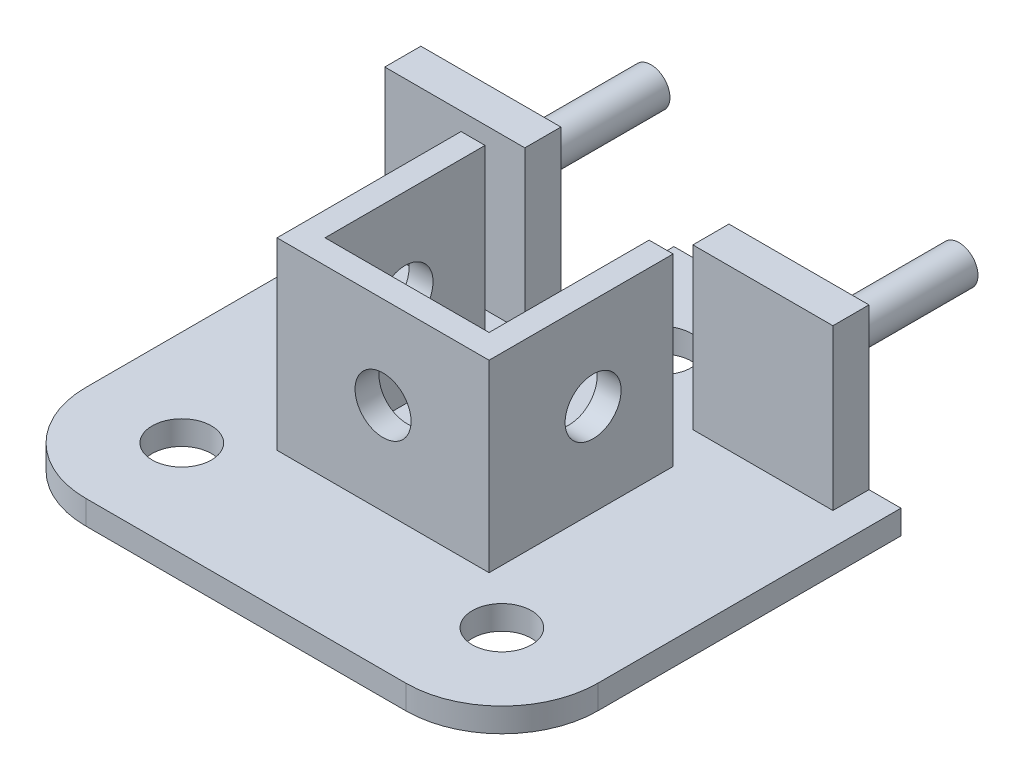
from build123d import *

# Parameters (mm, degrees)
SKETCH1_R           = 3.7
BOSS_EXTRUDE1_DEPTH = 3
SKETCH2_W           = 17.5
SKETCH2_H           = 4.507827608
BOSS_EXTRUDE2_DEPTH = 20
SKETCH3_R           = 2.375
BOSS_EXTRUDE3_DEPTH = 20
CUT_EXTRUDE1_REACH  = 71.092
SKETCH6_W           = 3
SKETCH6_H           = 20
BOSS_EXTRUDE4_DEPTH = 23
CUT_EXTRUDE2_REACH  = 79.931
SKETCH7_R           = 3.5
CUT_EXTRUDE3_REACH  = 68.934
SKETCH8_R           = 3.5


with BuildPart() as part:
    # Sketch1 → Boss-Extrude1 (new body)
    with BuildSketch(Plane(origin=(0, 0, 0), x_dir=(1, 0, 0), z_dir=(0, 1, 0))):
        with BuildLine():
            Line((-32, 0), (-32, 40))
            ThreePointArc((-32, 40), (-28.485281374, 48.485281374), (-20, 52))
            Line((-20, 52), (20, 52))
            ThreePointArc((20, 52), (28.485281374, 48.485281374), (32, 40))
            Line((32, 40), (32, 0))
            ThreePointArc((32, 0), (28.485281374, -8.485281374), (20, -12))
            Line((20, -12), (-20, -12))
            ThreePointArc((-20, -12), (-28.485281374, -8.485281374), (-32, 0))
        make_face()
        with Locations(Location((20, 0, 0), (0, 0, 270))):
            Circle(SKETCH1_R, mode=Mode.SUBTRACT)
        with Locations(Location((-20, 0, 0), (0, 0, 270))):
            Circle(SKETCH1_R, mode=Mode.SUBTRACT)
        with Locations(Location((0, 40, 0), (0, 0, 270))):
            Circle(SKETCH1_R, mode=Mode.SUBTRACT)
    extrude(amount=BOSS_EXTRUDE1_DEPTH)

    # Sketch2 → Boss-Extrude2 (add)
    with BuildSketch(Plane(origin=(0, 3, 0), x_dir=(1, 0, 0), z_dir=(0, 1, 0))):
        with Locations((19.25, 35.622787036)):
            Rectangle(SKETCH2_W, SKETCH2_H)
        with Locations((-19.25, 35.622787036)):
            Rectangle(SKETCH2_W, SKETCH2_H)
    extrude(amount=BOSS_EXTRUDE2_DEPTH)

    # Sketch3 → Boss-Extrude3 (add)
    with BuildSketch(Plane(origin=(0, 0, -37.87670084), x_dir=(-1, 0, 0), z_dir=(0, 0, -1))):
        with Locations(Location((-19.25, 13, 0), (0, 0, 180))):
            Circle(SKETCH3_R)
        with Locations(Location((19.25, 13, 0), (0, 0, 180))):
            Circle(SKETCH3_R)
    extrude(amount=BOSS_EXTRUDE3_DEPTH)

    # Sketch5 → Cut-Extrude1 (cut, up to next)
    with BuildSketch(Plane(origin=(0, 3, 0), x_dir=(1, 0, 0), z_dir=(0, 1, 0)), mode=Mode.PRIVATE) as cut_extrude1_sk1:
        with BuildLine():
            Line((-32, 37.87670084), (-10.5, 37.87670084))
            Line((-10.5, 37.87670084), (-10.5, 52))
            Line((-10.5, 52), (-20, 52))
            ThreePointArc((-20, 52), (-28.485281374, 48.485281374), (-32, 40))
            Line((-32, 40), (-32, 37.87670084))
        make_face()
    cut_extrude1_tool1 = extrude(cut_extrude1_sk1.sketch, amount=-CUT_EXTRUDE1_REACH, mode=Mode.PRIVATE) & part.part
    # Sketch5 → Cut-Extrude1 (cut, up to next)
    with BuildSketch(Plane(origin=(0, 3, 0), x_dir=(1, 0, 0), z_dir=(0, 1, 0)), mode=Mode.PRIVATE) as cut_extrude1_sk2:
        with BuildLine():
            Line((32, 37.87670084), (10.5, 37.87670084))
            Line((10.5, 37.87670084), (10.5, 52))
            Line((10.5, 52), (20, 52))
            ThreePointArc((20, 52), (28.485281374, 48.485281374), (32, 40))
            Line((32, 40), (32, 37.87670084))
        make_face()
    cut_extrude1_tool2 = extrude(cut_extrude1_sk2.sketch, amount=-CUT_EXTRUDE1_REACH, mode=Mode.PRIVATE) & part.part
    add(cut_extrude1_tool1.solids().sort_by_distance((-20.335708, 3, -44.441952))[0], mode=Mode.SUBTRACT)
    add(cut_extrude1_tool2.solids().sort_by_distance((20.335708, 3, -44.441952))[0], mode=Mode.SUBTRACT)

    # Sketch6 → Boss-Extrude4 (add)
    with BuildSketch(Plane(origin=(0, 3, 0), x_dir=(1, 0, 0), z_dir=(0, 1, 0))):
        with Locations((-11.75, 18.15)):
            Rectangle(SKETCH6_W, SKETCH6_H)
        Polygon((13.25, 8.15), (10.25, 8.15), (-10.25, 8.15), (-13.25, 8.15), (-13.25, 5.15), (13.25, 5.15), align=None)
        with Locations((11.75, 18.15)):
            Rectangle(SKETCH6_W, SKETCH6_H)
    extrude(amount=BOSS_EXTRUDE4_DEPTH)

    # Cut-Extrude2: up to this face of the body (flat: up to its plane)
    cut_extrude2_end = Plane(part.part.faces().sort_by_distance((13.25, 14.5, -16.65))[0])
    # Sketch7 → Cut-Extrude2 (cut, up to the picked face)
    with BuildSketch(Plane.ZY.offset(13.25), mode=Mode.PRIVATE) as cut_extrude2_sk1:
        with Locations((-18.15, 14.5)):
            Circle(SKETCH7_R)
    cut_extrude2_tool1 = split(extrude(cut_extrude2_sk1.sketch, amount=-CUT_EXTRUDE2_REACH, mode=Mode.PRIVATE), bisect_by=cut_extrude2_end, keep=Keep.BOTH, mode=Mode.PRIVATE)
    add(cut_extrude2_tool1.solids().sort_by(Axis((-13.25, 14.5, -18.15), (1, 0, 0)))[0], mode=Mode.SUBTRACT)

    # Sketch8 → Cut-Extrude3 (cut, up to next)
    with BuildSketch(Plane.XY.offset(-5.15), mode=Mode.PRIVATE) as cut_extrude3_sk1:
        with Locations((0, 14.5)):
            Circle(SKETCH8_R)
    cut_extrude3_tool1 = extrude(cut_extrude3_sk1.sketch, amount=-CUT_EXTRUDE3_REACH, mode=Mode.PRIVATE) & part.part
    add(cut_extrude3_tool1.solids().sort_by_distance((0, 14.5, -5.15))[0], mode=Mode.SUBTRACT)


solid = part.part
